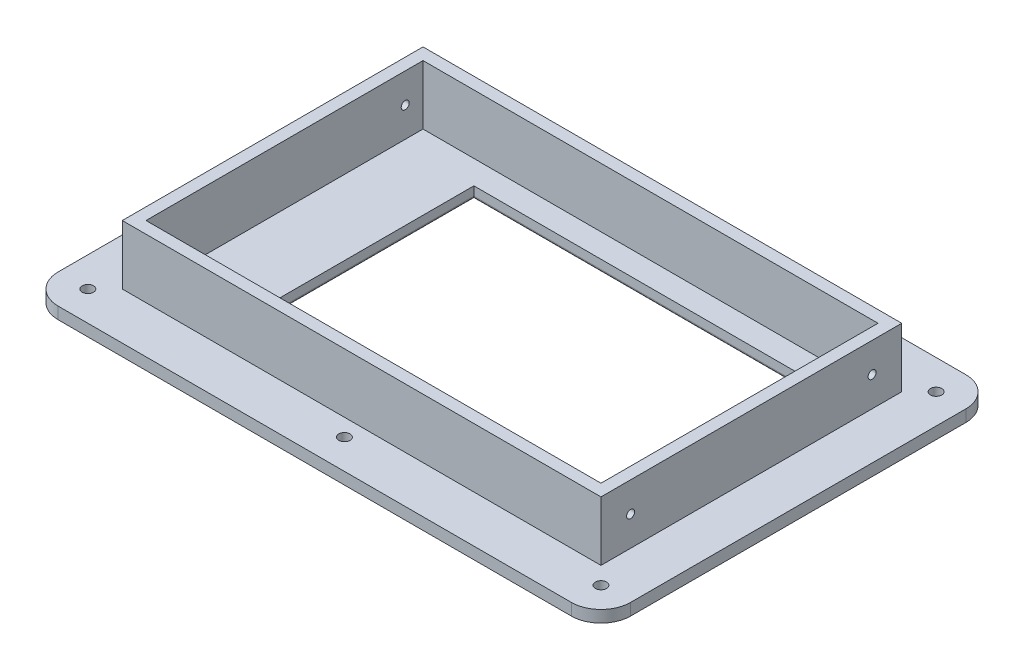
from build123d import *

# Parameters (mm, degrees)
SKETCH1_W                    = 193
SKETCH1_H                    = 133
BOSS_EXTRUDE1_DEPTH          = 4
SKETCH2_W                    = 161.4
SKETCH2_H                    = 101.4
SKETCH2_W_2                  = 153.4
SKETCH2_H_2                  = 93.4
EXTRUDE_THIN1_DEPTH          = 20
SKETCH3_W                    = 112
SKETCH3_H                    = 70.9
CUT_EXTRUDE3_DEPTH           = 15
FILLET1_R                    = 1
F_25_0_1495_DIAMETER_HOLE2_D = 3.7973
FILLET3_R                    = 10
TAP_DRILL_FOR_6_32_TAP1_D    = 2.7051


with BuildPart() as part:
    # Sketch1 → Boss-Extrude1 (new body)
    with BuildSketch(Plane(origin=(0, 0, 0), x_dir=(1, 0, 0), z_dir=(0, 1, 0))):
        Rectangle(SKETCH1_W, SKETCH1_H)
    extrude(amount=BOSS_EXTRUDE1_DEPTH)

    # Sketch2 → Extrude-Thin1 (add)
    with BuildSketch(Plane(origin=(0, 4, 0), x_dir=(1, 0, 0), z_dir=(0, 1, 0))):
        Rectangle(SKETCH2_W, SKETCH2_H)
        Rectangle(SKETCH2_W_2, SKETCH2_H_2, mode=Mode.SUBTRACT)
    extrude(amount=EXTRUDE_THIN1_DEPTH)

    # Sketch3 → Cut-Extrude3 (cut)
    with BuildSketch(Plane.XZ):
        with Locations((4.45, -3.25)):
            Rectangle(SKETCH3_W, SKETCH3_H)
    extrude(amount=-CUT_EXTRUDE3_DEPTH, mode=Mode.SUBTRACT)

    # Fillet1
    fillet1_edges = [part.edges().sort_by_distance(p)[0] for p in [
        (60.45, 0, -3.25),
        (4.45, 0, 32.2),
        (-51.55, 0, -3.25),
        (4.45, 0, -38.7),
    ]]
    fillet(fillet1_edges, radius=FILLET1_R)

    # #25 (0.1495) Diameter Hole2 (through all)
    with Locations(Plane(origin=(0, 0, 0), x_dir=(-1, 0, 0), z_dir=(0, -1, 0))):
        with Locations((86.5, -56.5), (86.5, 56.5), (-86.5, 56.5), (-86.5, -56.5), (0, -56.5), (0, 56.5)):
            Hole(F_25_0_1495_DIAMETER_HOLE2_D / 2)

    # Fillet3
    fillet3_edges = [part.edges().sort_by_distance(p)[0] for p in [
        (96.5, 2, 66.5),
        (-96.5, 2, 66.5),
        (-96.5, 2, -66.5),
        (96.5, 2, -66.5),
    ]]
    fillet(fillet3_edges, radius=FILLET3_R)

    # Tap Drill for #6-32 Tap1 (through all)
    with Locations(Plane.ZY.offset(80.7)):
        with Locations((-40.7, 14), (40.7, 14)):
            Hole(TAP_DRILL_FOR_6_32_TAP1_D / 2)


solid = part.part
